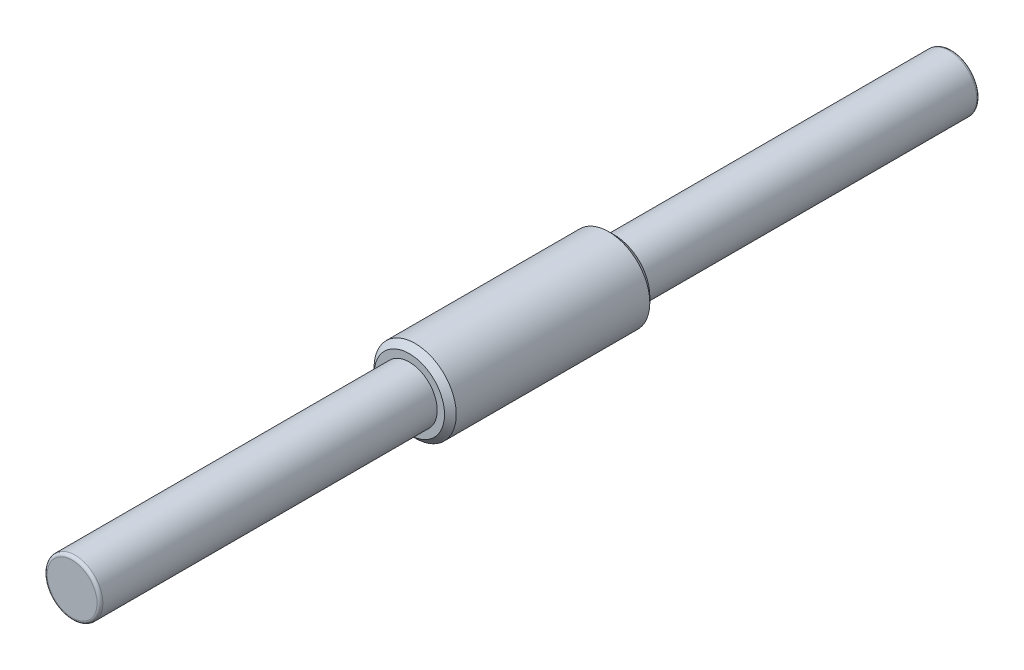
from build123d import *

# Parameters (mm, degrees)
SKETCH1_R           = 0.475
BOSS_EXTRUDE1_DEPTH = 7.5
BOSS_EXTRUDE2_START = -5.75
SKETCH2_R           = 0.7
BOSS_EXTRUDE2_DEPTH = 3.5
CHAMFER1_SIZE       = 0.1
FILLET1_R           = 0.05


with BuildPart() as part:
    # Sketch1 → Boss-Extrude1 (new, symmetric)
    with BuildSketch(Plane.XY):
        Circle(SKETCH1_R)
    extrude(amount=BOSS_EXTRUDE1_DEPTH, both=True)

    # Fillet1
    fillet1_edges = [part.edges().sort_by_distance(p)[0] for p in [
        (-0.475, 0, -7.5),
        (-0.475, 0, 7.5),
    ]]
    fillet(fillet1_edges, radius=FILLET1_R)


with BuildPart() as body_2:
    # Sketch2 → Boss-Extrude2 (new body)
    with BuildSketch(Plane.XY.offset(7.5).offset(BOSS_EXTRUDE2_START)):
        Circle(SKETCH2_R)
    extrude(amount=-BOSS_EXTRUDE2_DEPTH)

    # Chamfer1
    chamfer1_edges = [body_2.edges().sort_by_distance(p)[0] for p in [
        (-0.7, 0, 1.75),
        (-0.7, 0, -1.75),
    ]]
    chamfer(chamfer1_edges, length=CHAMFER1_SIZE)


solid = Compound([part.part, body_2.part])
